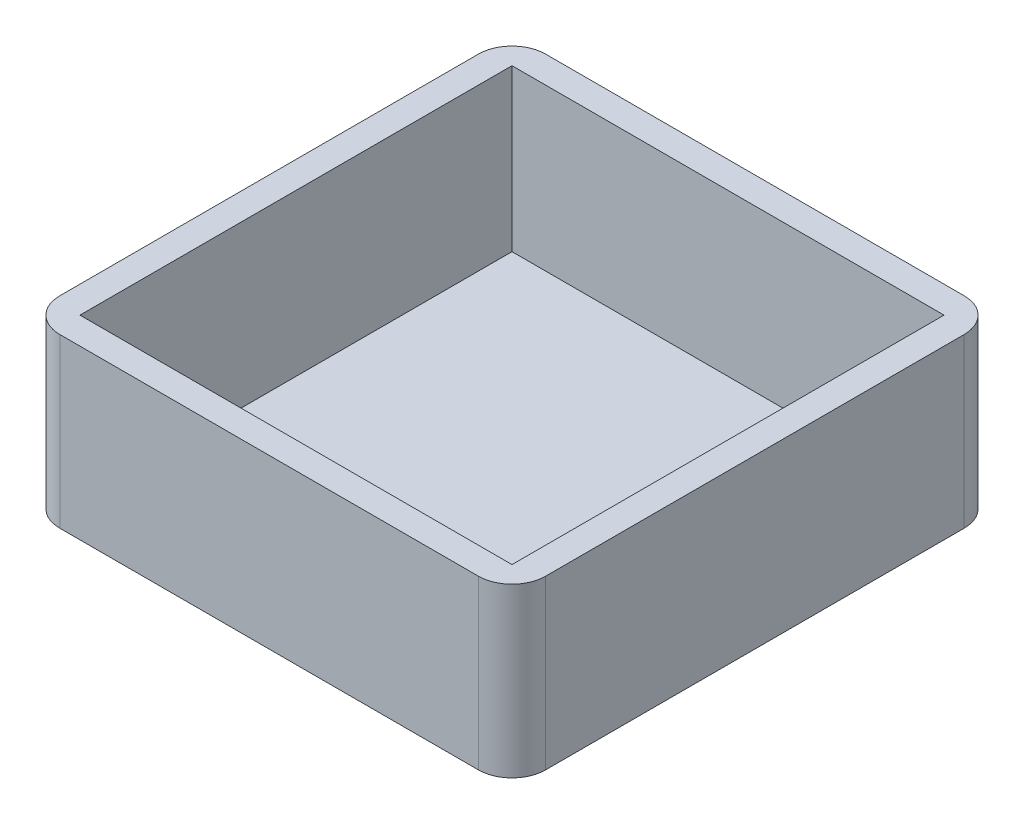
from build123d import *

# Parameters (mm, degrees)
SKETCH1_W           = 144.752014146
SKETCH1_H           = 144.752014146
BOSS_EXTRUDE1_DEPTH = 50
SKETCH2_W           = 128.752014146
SKETCH2_H           = 128.752014146
CUT_EXTRUDE1_DEPTH  = 48
FILLET1_R           = 10


with BuildPart() as part:
    # Sketch1 → Boss-Extrude1 (new body)
    with BuildSketch(Plane(origin=(0, 0, 0), x_dir=(1, 0, 0), z_dir=(0, 1, 0))):
        Rectangle(SKETCH1_W, SKETCH1_H)
    extrude(amount=BOSS_EXTRUDE1_DEPTH)

    # Sketch2 → Cut-Extrude1 (cut)
    with BuildSketch(Plane(origin=(0, 50, 0), x_dir=(1, 0, 0), z_dir=(0, 1, 0))):
        Rectangle(SKETCH2_W, SKETCH2_H)
    extrude(amount=-CUT_EXTRUDE1_DEPTH, mode=Mode.SUBTRACT)

    # Fillet1
    fillet1_edges = [part.edges().sort_by_distance(p)[0] for p in [
        (72.376007073, 25, 72.376007073),
        (-72.376007073, 25, 72.376007073),
        (-72.376007073, 25, -72.376007073),
        (72.376007073, 25, -72.376007073),
    ]]
    fillet(fillet1_edges, radius=FILLET1_R)


solid = part.part
